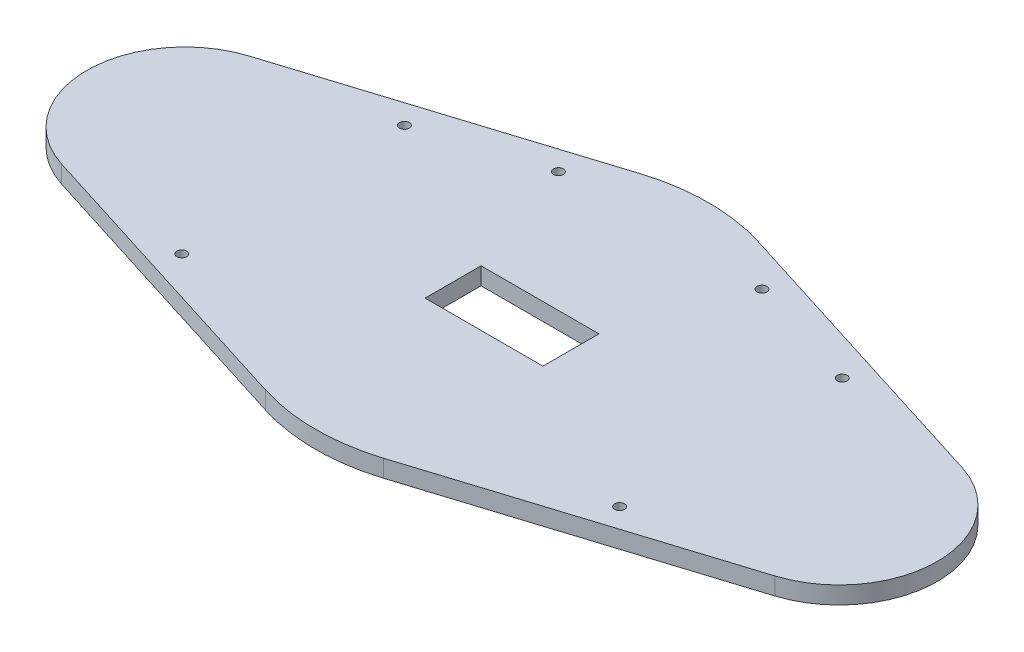
from build123d import *

# Parameters (mm, degrees)
SKETCH1_R           = 1.27
SKETCH1_W           = 30.48
SKETCH1_H           = 14.478
BOSS_EXTRUDE1_DEPTH = 4.4958


with BuildPart() as part:
    # Sketch1 → Boss-Extrude1 (new body)
    with BuildSketch(Plane(origin=(0, 0, 0), x_dir=(1, 0, 0), z_dir=(0, 1, 0))):
        with BuildLine():
            Line((-92.209627628, 24.227655619), (-15.255255255, 48.455311237))
            ThreePointArc((-15.255255255, 48.455311237), (0, 50.8), (15.255255255, 48.455311237))
            Line((15.255255255, 48.455311237), (92.209627628, 24.227655619))
            ThreePointArc((92.209627628, 24.227655619), (109.982, 0), (92.209627628, -24.227655619))
            Line((92.209627628, -24.227655619), (15.255255255, -48.455311237))
            ThreePointArc((15.255255255, -48.455311237), (0, -50.8), (-15.255255255, -48.455311237))
            Line((-15.255255255, -48.455311237), (-92.209627628, -24.227655619))
            ThreePointArc((-92.209627628, -24.227655619), (-109.982, 0), (-92.209627628, 24.227655619))
        make_face()
        with Locations(Location((-56.603365496, 28.780358137, 0), (0, 0, 270))):
            Circle(SKETCH1_R, mode=Mode.SUBTRACT)
        with Locations(Location((-56.603365496, -28.780358137, 0), (0, 0, 270))):
            Circle(SKETCH1_R, mode=Mode.SUBTRACT)
        with Locations(Location((56.603365496, -28.780358137, 0), (0, 0, 270))):
            Circle(SKETCH1_R, mode=Mode.SUBTRACT)
        with Locations(Location((56.603365496, 28.780358137, 0), (0, 0, 270))):
            Circle(SKETCH1_R, mode=Mode.SUBTRACT)
        with Locations(Location((-26.314105966, 38.316369233, 0), (0, 0, 270))):
            Circle(SKETCH1_R, mode=Mode.SUBTRACT)
        with Locations(Location((26.314105966, 38.316369233, 0), (0, 0, 270))):
            Circle(SKETCH1_R, mode=Mode.SUBTRACT)
        Rectangle(SKETCH1_W, SKETCH1_H, mode=Mode.SUBTRACT)
    extrude(amount=BOSS_EXTRUDE1_DEPTH)


solid = part.part
